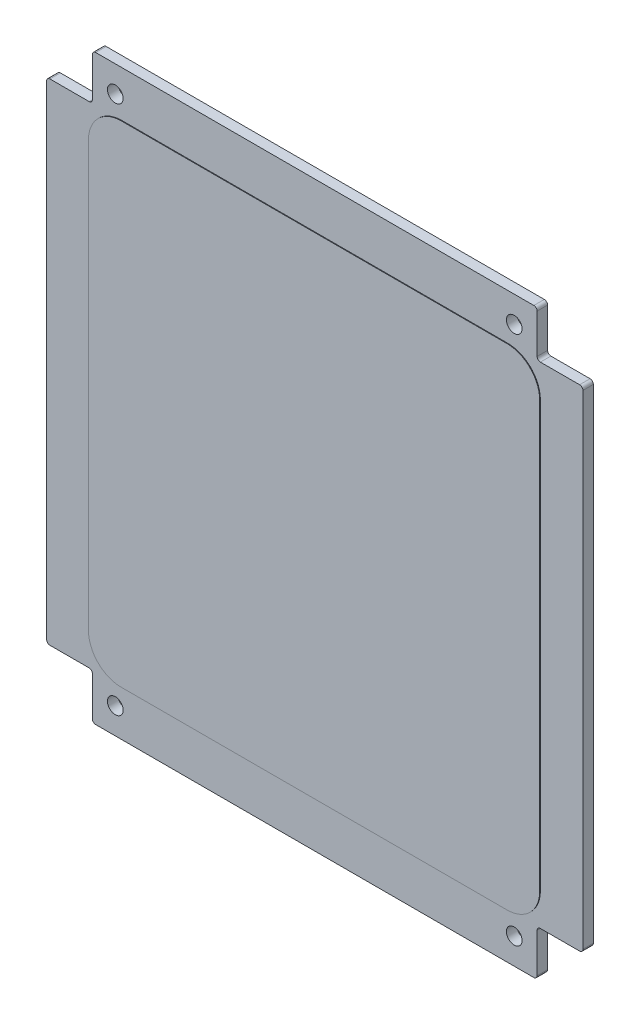
from build123d import *

# Parameters (mm, degrees)
BOSS_EXTRUDE1_DEPTH            = 1.6
BOSS_EXTRUDE2_DEPTH            = 0.1
M2_HOLE1_FIXINGSTRUCTURE_D     = 2.4
M2_HOLE1_FIXINGSTRUCTURE_DEPTH = 200
M2_HOLE1_FIXINGSTRUCTURE_TIP   = 0.721032743


with BuildPart() as part:
    # Sketch1 → Boss-Extrude1 (new body)
    with BuildSketch(Plane.XY):
        with BuildLine():
            Line((-34, 44), (-34, 38))
            ThreePointArc((-34, 38), (-34.146446609, 37.646446609), (-34.5, 37.5))
            Line((-34.5, 37.5), (-40.5, 37.5))
            ThreePointArc((-40.5, 37.5), (-40.853553391, 37.353553391), (-41, 37))
            Line((-41, 37), (-41, -37))
            ThreePointArc((-41, -37), (-40.853553391, -37.353553391), (-40.5, -37.5))
            Line((-40.5, -37.5), (-34.5, -37.5))
            ThreePointArc((-34.5, -37.5), (-34.146446609, -37.646446609), (-34, -38))
            Line((-34, -38), (-34, -44))
            ThreePointArc((-34, -44), (-33.853553391, -44.353553391), (-33.5, -44.5))
            Line((-33.5, -44.5), (33.5, -44.5))
            ThreePointArc((33.5, -44.5), (33.853553391, -44.353553391), (34, -44))
            Line((34, -44), (34, -38))
            ThreePointArc((34, -38), (34.146446609, -37.646446609), (34.5, -37.5))
            Line((34.5, -37.5), (40.5, -37.5))
            ThreePointArc((40.5, -37.5), (40.853553391, -37.353553391), (41, -37))
            Line((41, -37), (41, 37))
            ThreePointArc((41, 37), (40.853553391, 37.353553391), (40.5, 37.5))
            Line((40.5, 37.5), (34.5, 37.5))
            ThreePointArc((34.5, 37.5), (34.146446609, 37.646446609), (34, 38))
            Line((34, 38), (34, 44))
            ThreePointArc((34, 44), (33.853553391, 44.353553391), (33.5, 44.5))
            Line((33.5, 44.5), (-33.5, 44.5))
            ThreePointArc((-33.5, 44.5), (-33.853553391, 44.353553391), (-34, 44))
        make_face()
    extrude(amount=BOSS_EXTRUDE1_DEPTH)

    # Esboço1 → Boss-Extrude2 (add)
    with BuildSketch(Plane.XY.offset(1.6)):
        with BuildLine():
            Line((-29.5, -37.5), (29.5, -37.5))
            ThreePointArc((29.5, -37.5), (33.035533906, -36.035533906), (34.5, -32.5))
            Line((34.5, -32.5), (34.5, 32.5))
            ThreePointArc((34.5, 32.5), (33.035533906, 36.035533906), (29.5, 37.5))
            Line((29.5, 37.5), (-29.5, 37.5))
            ThreePointArc((-29.5, 37.5), (-33.035533906, 36.035533906), (-34.5, 32.5))
            Line((-34.5, 32.5), (-34.5, -32.5))
            ThreePointArc((-34.5, -32.5), (-33.035533906, -36.035533906), (-29.5, -37.5))
        make_face()
    extrude(amount=BOSS_EXTRUDE2_DEPTH)

    # M2 Hole1-FixingStructure
    with Locations(Plane(origin=(0, 0, 0), x_dir=(-1, 0, 0), z_dir=(0, 0, -1))):
        with Locations((-30.5, 40.5), (30.5, 40.5), (-30.5, -40.5), (30.5, -40.5)):
            Hole(M2_HOLE1_FIXINGSTRUCTURE_D / 2, depth=M2_HOLE1_FIXINGSTRUCTURE_DEPTH)
            with Locations((0, 0, -(M2_HOLE1_FIXINGSTRUCTURE_DEPTH + M2_HOLE1_FIXINGSTRUCTURE_TIP / 2))):  # 118° drill point
                Cone(0, M2_HOLE1_FIXINGSTRUCTURE_D / 2, M2_HOLE1_FIXINGSTRUCTURE_TIP, mode=Mode.SUBTRACT)


solid = part.part
